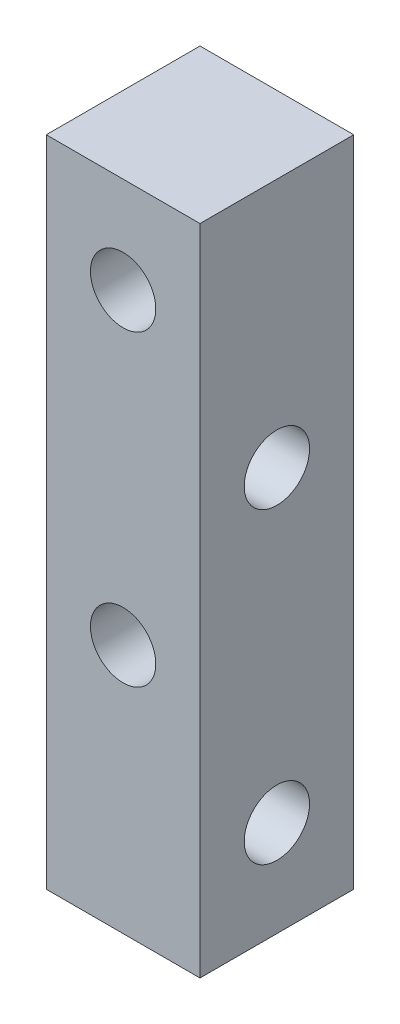
from build123d import *

# Parameters (mm, degrees)
SKETCH_1_W          = 8
SKETCH_1_H          = 8
EXTRUDE_1_DEPTH     = 34
SKETCH_2_R          = 1.7
CUT_EXTRUDE_1_DEPTH = 34
SKETCH_3_R          = 1.7
CUT_EXTRUDE_2_DEPTH = 34


with BuildPart() as part:
    # 草图1 → 凸台-拉伸1 (new body)
    with BuildSketch(Plane(origin=(0, 0, 0), x_dir=(1, 0, 0), z_dir=(0, 1, 0))):
        Rectangle(SKETCH_1_W, SKETCH_1_H)
    extrude(amount=EXTRUDE_1_DEPTH)

    # 草图2 → 切除-拉伸1 (cut)
    with BuildSketch(Plane(origin=(0, 0, -4), x_dir=(-1, 0, 0), z_dir=(0, 0, -1))):
        with Locations((0, 29)):
            Circle(SKETCH_2_R)
        with Locations((0, 13)):
            Circle(SKETCH_2_R)
    extrude(amount=-CUT_EXTRUDE_1_DEPTH, mode=Mode.SUBTRACT)

    # 草图3 → 切除-拉伸2 (cut)
    with BuildSketch(Plane(origin=(4, 0, 0), x_dir=(0, 0, -1), z_dir=(1, 0, 0))):
        with Locations((0, 5)):
            Circle(SKETCH_3_R)
        with Locations((0, 21)):
            Circle(SKETCH_3_R)
    extrude(amount=-CUT_EXTRUDE_2_DEPTH, mode=Mode.SUBTRACT)


solid = part.part
